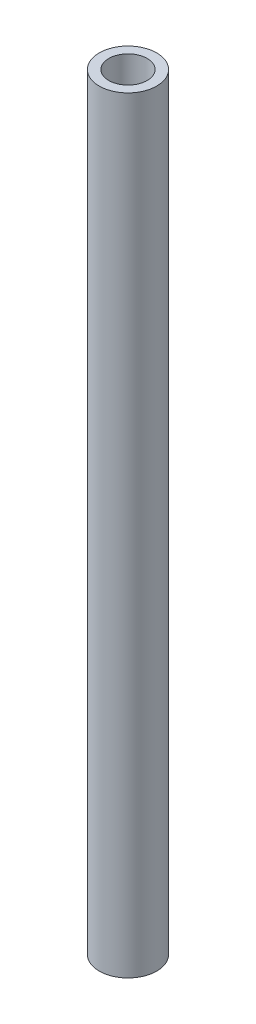
from build123d import *

# Parameters (mm, degrees)
SKETCH_1_R      = 3
SKETCH_1_R_2    = 2
EXTRUDE_1_DEPTH = 80


with BuildPart() as part:
    # 草图1 → 凸台-拉伸1 (new body)
    with BuildSketch(Plane(origin=(0, 0, 0), x_dir=(1, 0, 0), z_dir=(0, 1, 0))):
        with Locations(Location((0, 0, 0), (0, 0, 270))):
            Circle(SKETCH_1_R)
        with Locations(Location((0, 0, 0), (0, 0, 270))):
            Circle(SKETCH_1_R_2, mode=Mode.SUBTRACT)
    extrude(amount=EXTRUDE_1_DEPTH)


solid = part.part
